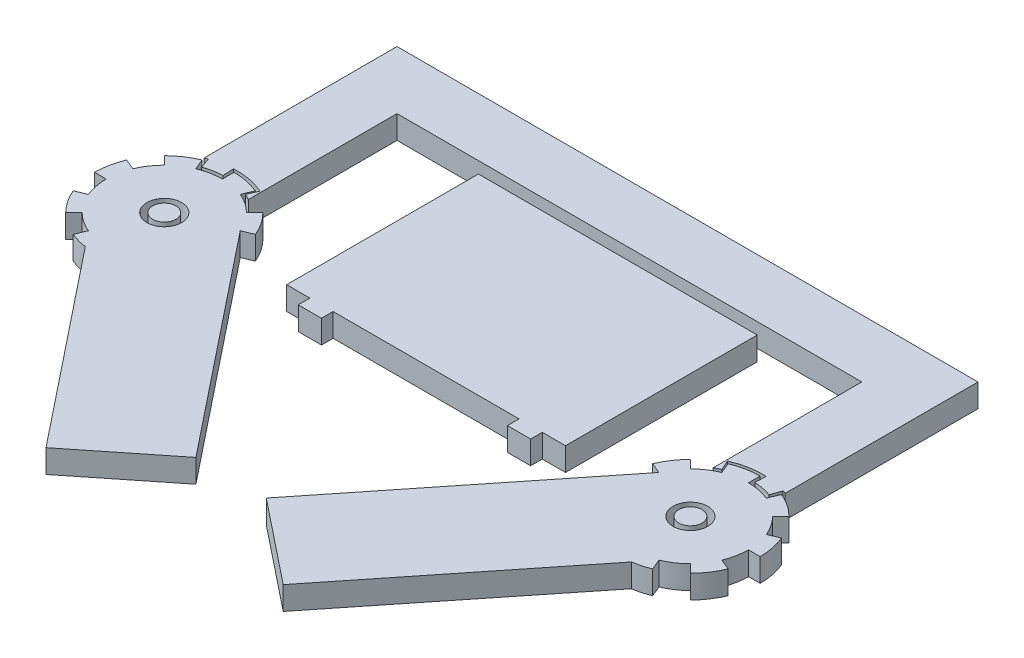
from build123d import *

# Parameters (mm, degrees)
SKETCH1_R             = 1.498045306
BOSS_EXTRUDE2_DEPTH   = 2
BOSS_EXTRUDE2_2_DEPTH = 2
BOSS_EXTRUDE2_3_DEPTH = 2
BOSS_EXTRUDE2_4_DEPTH = 2
SKETCH2_R             = 1
BOSS_EXTRUDE4_DEPTH   = 2
BOSS_EXTRUDE4_2_DEPTH = 2


with BuildPart() as part:
    # Sketch1 → Boss-Extrude2 (new body)
    with BuildSketch(Plane(origin=(0, 0, 0), x_dir=(1, 0, 0), z_dir=(0, 1, 0))):
        with BuildLine():
            ThreePointArc((24.93426242, -5.432691005), (24.22975243, -5.674466908), (23.500714707, -5.827090336))
            Line((23.500714707, -5.827090336), (10.20772594, -22.502760482))
            Line((10.20772594, -22.502760482), (3.025571641, -16.777515525))
            Line((3.025571641, -16.777515525), (18.013147942, 2.023965696))
            Line((18.013147942, 2.023965696), (17.094049208, 2.404668857))
            ThreePointArc((17.094049208, 2.404668857), (17.648737545, 3.443099558), (18.395521139, 4.353226878))
            Line((18.395521139, 4.353226878), (19.10262792, 3.646120096))
            ThreePointArc((19.10262792, 3.646120096), (19.860310661, 4.267934252), (20.724744664, 4.729983853))
            Line((20.724744664, 4.729983853), (20.342061232, 5.653863385))
            ThreePointArc((20.342061232, 5.653863385), (21.467619894, 5.995297873), (22.638161826, 6.11058619))
            Line((22.638161826, 6.11058619), (22.638161826, 5.11058619))
            ThreePointArc((22.638161826, 5.11058619), (23.613613436, 5.014512592), (24.551578988, 4.729983853))
            Line((24.551578988, 4.729983853), (24.93426242, 5.653863385))
            ThreePointArc((24.93426242, 5.653863385), (25.971583224, 5.099403864), (26.880802513, 4.353226878))
            Line((26.880802513, 4.353226878), (26.173695732, 3.646120096))
            ThreePointArc((26.173695732, 3.646120096), (26.795509888, 2.888437355), (27.257559489, 2.024003352))
            Line((27.257559489, 2.024003352), (28.181439021, 2.406686785))
            ThreePointArc((28.181439021, 2.406686785), (28.522873509, 1.281128122), (28.638161826, 0.11058619))
            Line((28.638161826, 0.11058619), (27.638161826, 0.11058619))
            ThreePointArc((27.638161826, 0.11058619), (27.542088228, -0.86486542), (27.257559489, -1.802830971))
            Line((27.257559489, -1.802830971), (28.181439021, -2.185514404))
            ThreePointArc((28.181439021, -2.185514404), (27.6269795, -3.222835208), (26.880802513, -4.132054497))
            Line((26.880802513, -4.132054497), (26.173695732, -3.424947716))
            ThreePointArc((26.173695732, -3.424947716), (25.416012991, -4.046761871), (24.551578988, -4.508811472))
            Line((24.551578988, -4.508811472), (24.93426242, -5.432691005))
        make_face()
        with Locations(Location((22.638161826, 0.11058619, 0), (0, 0, 270))):
            Circle(SKETCH1_R, mode=Mode.SUBTRACT)
    extrude(amount=BOSS_EXTRUDE2_DEPTH)


with BuildPart() as body_2:
    # Sketch1 → Boss-Extrude2 2 (new body)
    with BuildSketch(Plane(origin=(0, 0, 0), x_dir=(1, 0, 0), z_dir=(0, 1, 0))):
        with BuildLine():
            Line((-28.638161826, 0.11058619), (-27.638161826, 0.11058619))
            ThreePointArc((-27.638161826, 0.11058619), (-27.542088228, -0.86486542), (-27.257559489, -1.802830971))
            Line((-27.257559489, -1.802830971), (-28.181439021, -2.185514404))
            ThreePointArc((-28.181439021, -2.185514404), (-27.6269795, -3.222835208), (-26.880802513, -4.132054497))
            Line((-26.880802513, -4.132054497), (-26.173695732, -3.424947716))
            ThreePointArc((-26.173695732, -3.424947716), (-25.416012991, -4.046761871), (-24.551578988, -4.508811472))
            Line((-24.551578988, -4.508811472), (-24.93426242, -5.432691005))
            ThreePointArc((-24.93426242, -5.432691005), (-24.22975243, -5.674466908), (-23.500714707, -5.827090336))
            Line((-23.500714707, -5.827090336), (-10.209926455, -22.5))
            Line((-10.209926455, -22.5), (-3.031187863, -16.777477869))
            Line((-3.031187863, -16.777477869), (-18.018764164, 2.024003352))
            Line((-18.018764164, 2.024003352), (-17.094884631, 2.406686785))
            ThreePointArc((-17.094884631, 2.406686785), (-17.649344152, 3.444007589), (-18.395521139, 4.353226878))
            Line((-18.395521139, 4.353226878), (-19.10262792, 3.646120096))
            ThreePointArc((-19.10262792, 3.646120096), (-19.860310661, 4.267934252), (-20.724744664, 4.729983853))
            Line((-20.724744664, 4.729983853), (-20.342061232, 5.653863385))
            ThreePointArc((-20.342061232, 5.653863385), (-21.467619894, 5.995297873), (-22.638161826, 6.11058619))
            Line((-22.638161826, 6.11058619), (-22.638161826, 5.11058619))
            ThreePointArc((-22.638161826, 5.11058619), (-23.613613436, 5.014512592), (-24.551578988, 4.729983853))
            Line((-24.551578988, 4.729983853), (-24.93426242, 5.653863385))
            ThreePointArc((-24.93426242, 5.653863385), (-25.971583224, 5.099403864), (-26.880802513, 4.353226878))
            Line((-26.880802513, 4.353226878), (-26.173695732, 3.646120096))
            ThreePointArc((-26.173695732, 3.646120096), (-26.795509888, 2.888437355), (-27.257559489, 2.024003352))
            Line((-27.257559489, 2.024003352), (-28.181439021, 2.406686785))
            ThreePointArc((-28.181439021, 2.406686785), (-28.522873509, 1.281128122), (-28.638161826, 0.11058619))
        make_face()
        with Locations(Location((-22.638161826, 0.11058619, 0), (0, 0, 270))):
            Circle(SKETCH1_R, mode=Mode.SUBTRACT)
    extrude(amount=BOSS_EXTRUDE2_2_DEPTH)


with BuildPart() as body_3:
    # Sketch1 → Boss-Extrude2 3 (new body)
    with BuildSketch(Plane(origin=(0, 0, 0), x_dir=(1, 0, 0), z_dir=(0, 1, 0))):
        Polygon((10, 0), (10, -1), (8.003694636, -1), (8.003694636, 0), (0, 0), (-8.003694636, 0), (-8.003694636, -1), (-10, -1), (-10, 0), (-12, 0), (-12, 16.5), (12, 16.5), (12, 0), align=None)
    extrude(amount=BOSS_EXTRUDE2_3_DEPTH)


with BuildPart() as body_4:
    # Sketch1 → Boss-Extrude2 4 (new body)
    with BuildSketch(Plane(origin=(0, 0, 0), x_dir=(1, 0, 0), z_dir=(0, 1, 0))):
        with BuildLine():
            Line((20, 17.5), (20, 4.704387934))
            ThreePointArc((20, 4.704387934), (20.246889772, 4.837607477), (20.500485829, 4.957570161))
            Line((20.500485829, 4.957570161), (20.116101161, 5.829127088))
            ThreePointArc((20.116101161, 5.829127088), (21.489621214, 6.254148224), (22.923922413, 6.354050044))
            Line((22.923922413, 6.354050044), (22.880572318, 5.406911915))
            ThreePointArc((22.880572318, 5.406911915), (23.659669367, 5.31311936), (24.416388714, 5.105357273))
            Line((24.416388714, 5.105357273), (24.734387752, 5.998568601))
            ThreePointArc((24.734387752, 5.998568601), (24.867770705, 5.949365536), (25, 5.897141335))
            Line((25, 5.897141335), (25, 22.5))
            Line((25, 22.5), (-25, 22.5))
            Line((-25, 22.5), (-25, 5.897141335))
            ThreePointArc((-25, 5.897141335), (-24.867770705, 5.949365536), (-24.734387752, 5.998568601))
            Line((-24.734387752, 5.998568601), (-24.416388714, 5.105357273))
            ThreePointArc((-24.416388714, 5.105357273), (-23.659669367, 5.31311936), (-22.880572318, 5.406911915))
            Line((-22.880572318, 5.406911915), (-22.923922413, 6.354050044))
            ThreePointArc((-22.923922413, 6.354050044), (-21.489621214, 6.254148224), (-20.116101161, 5.829127088))
            Line((-20.116101161, 5.829127088), (-20.500485829, 4.957570161))
            ThreePointArc((-20.500485829, 4.957570161), (-20.246889772, 4.837607477), (-20, 4.704387934))
            Line((-20, 4.704387934), (-20, 17.5))
            Line((-20, 17.5), (20, 17.5))
        make_face()
    extrude(amount=BOSS_EXTRUDE2_4_DEPTH)


with BuildPart() as body_5:
    # Sketch2 → Boss-Extrude4 (new body)
    with BuildSketch(Plane(origin=(0, 0, 0), x_dir=(1, 0, 0), z_dir=(0, 1, 0))):
        with Locations(Location((22.638161826, 0.11058619, 0), (0, 0, 90))):
            Circle(SKETCH2_R)
    extrude(amount=BOSS_EXTRUDE4_DEPTH)


with BuildPart() as body_6:
    # Sketch2 → Boss-Extrude4 2 (new body)
    with BuildSketch(Plane(origin=(0, 0, 0), x_dir=(1, 0, 0), z_dir=(0, 1, 0))):
        with Locations(Location((-22.638161826, 0.11058619, 0), (0, 0, 270))):
            Circle(SKETCH2_R)
    extrude(amount=BOSS_EXTRUDE4_2_DEPTH)


solid = Compound([part.part, body_2.part, body_3.part, body_4.part, body_5.part, body_6.part])
